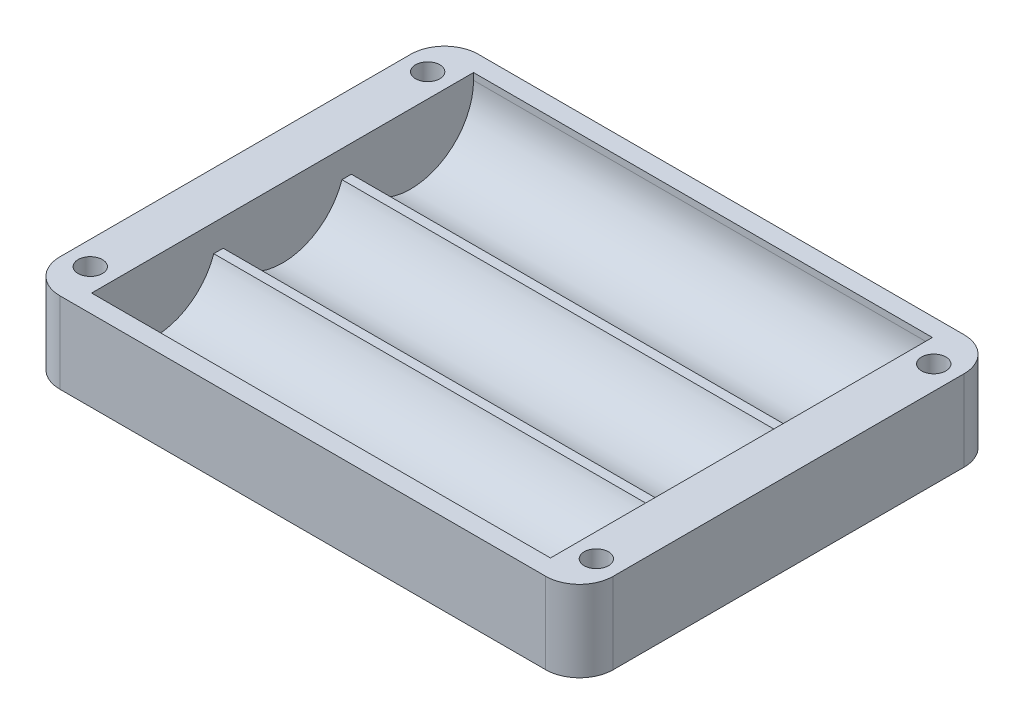
from build123d import *

# Parameters (mm, degrees)
BOSS_EXTRUDE1_DEPTH            = 12
CUT_EXTRUDE1_DEPTH             = 34
F_3_6_3_6_DIAMETER_HOLE1_D     = 3.6
F_3_6_3_6_DIAMETER_HOLE1_DEPTH = 10
F_3_6_3_6_DIAMETER_HOLE1_TIP   = 1.081549114


with BuildPart() as part:
    # Sketch1 → Boss-Extrude1 (new body)
    with BuildSketch(Plane(origin=(0, 0, 0), x_dir=(1, 0, 0), z_dir=(0, 1, 0))):
        with BuildLine():
            Line((-36, 31), (36, 31))
            ThreePointArc((36, 31), (39.535533906, 29.535533906), (41, 26))
            Line((41, 26), (41, -26))
            ThreePointArc((41, -26), (39.535533906, -29.535533906), (36, -31))
            Line((36, -31), (-36, -31))
            ThreePointArc((-36, -31), (-39.535533906, -29.535533906), (-41, -26))
            Line((-41, -26), (-41, 26))
            ThreePointArc((-41, 26), (-39.535533906, 29.535533906), (-36, 31))
        make_face()
    extrude(amount=BOSS_EXTRUDE1_DEPTH)

    # Sketch2 → Cut-Extrude1 (cut, symmetric)
    with BuildSketch(Plane(origin=(0, 0, 0), x_dir=(0, 0, -1), z_dir=(1, 0, 0))):
        with BuildLine():
            Line((-10.197159549, 8), (-8.802840451, 8))
            ThreePointArc((-8.802840451, 8), (0, 1.7), (8.802840451, 8))
            Line((8.802840451, 8), (10.197159549, 8))
            ThreePointArc((10.197159549, 8), (20.520457794, 1.825131712), (28.3, 11))
            Line((28.3, 11), (28.3, 17.866390663))
            Line((28.3, 17.866390663), (-28.3, 17.866390663))
            Line((-28.3, 17.866390663), (-28.3, 11))
            ThreePointArc((-28.3, 11), (-20.520457794, 1.825131712), (-10.197159549, 8))
        make_face()
    extrude(amount=CUT_EXTRUDE1_DEPTH, both=True, mode=Mode.SUBTRACT)

    # Ø3.6 (3.6) Diameter Hole1
    with Locations(Plane(origin=(0, 12, 0), x_dir=(1, 0, 0), z_dir=(0, 1, 0))):
        with Locations((-37.5, 25), (-37.5, -25), (37.5, -25), (37.5, 25)):
            Hole(F_3_6_3_6_DIAMETER_HOLE1_D / 2, depth=F_3_6_3_6_DIAMETER_HOLE1_DEPTH)
            with Locations((0, 0, -(F_3_6_3_6_DIAMETER_HOLE1_DEPTH + F_3_6_3_6_DIAMETER_HOLE1_TIP / 2))):  # 118° drill point
                Cone(0, F_3_6_3_6_DIAMETER_HOLE1_D / 2, F_3_6_3_6_DIAMETER_HOLE1_TIP, mode=Mode.SUBTRACT)


solid = part.part
